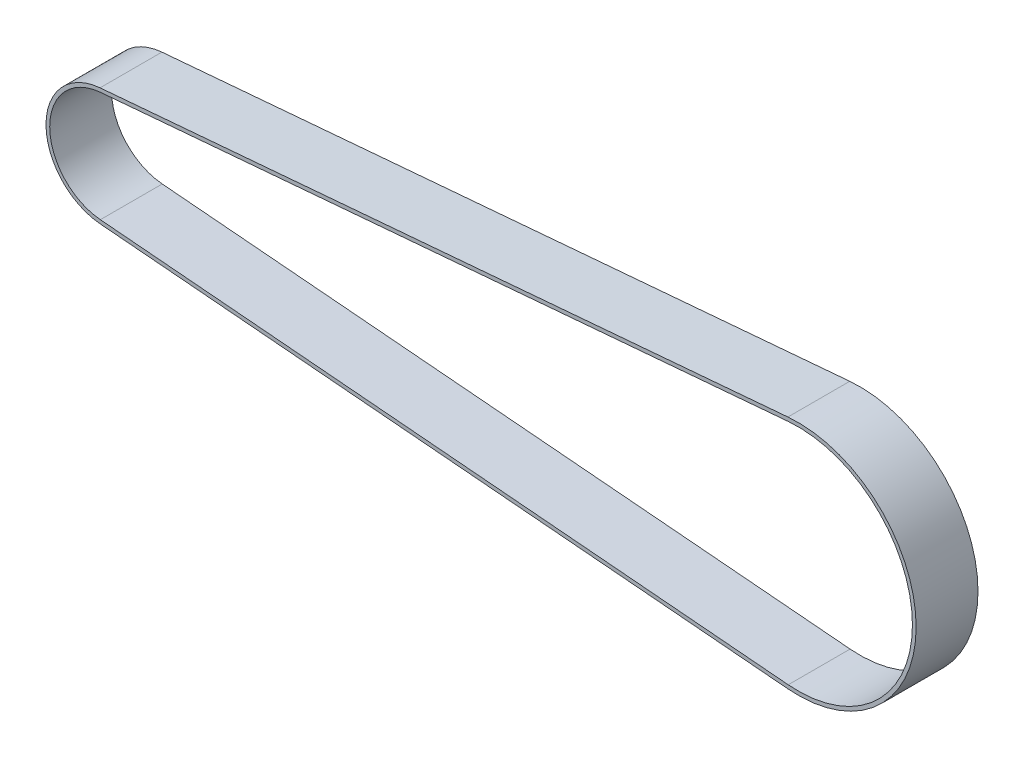
from build123d import *

# Parameters (mm, degrees)
BOSS_EXTRUDE1_DEPTH = 25


with BuildPart() as part:
    # Sketch1 → Boss-Extrude1 (new body)
    with BuildSketch(Plane.XY):
        with BuildLine():
            Line((-2.03534375, 23.78808527), (275.92973875, 47.571188742))
            ThreePointArc((275.92973875, 47.571188742), (327.745, 0), (275.92973875, -47.571188742))
            Line((275.92973875, -47.571188742), (-2.03534375, -23.78808527))
            ThreePointArc((-2.03534375, -23.78808527), (-23.875, 0), (-2.03534375, 23.78808527))
        make_face()
        with BuildLine():
            Line((-1.90746875, 22.293545881), (276.05761375, 46.076649354))
            ThreePointArc((276.05761375, 46.076649354), (326.245, 0), (276.05761375, -46.076649354))
            Line((276.05761375, -46.076649354), (-1.90746875, -22.293545881))
            ThreePointArc((-1.90746875, -22.293545881), (-22.375, 0), (-1.90746875, 22.293545881))
        make_face(mode=Mode.SUBTRACT)
    extrude(amount=BOSS_EXTRUDE1_DEPTH)


solid = part.part
